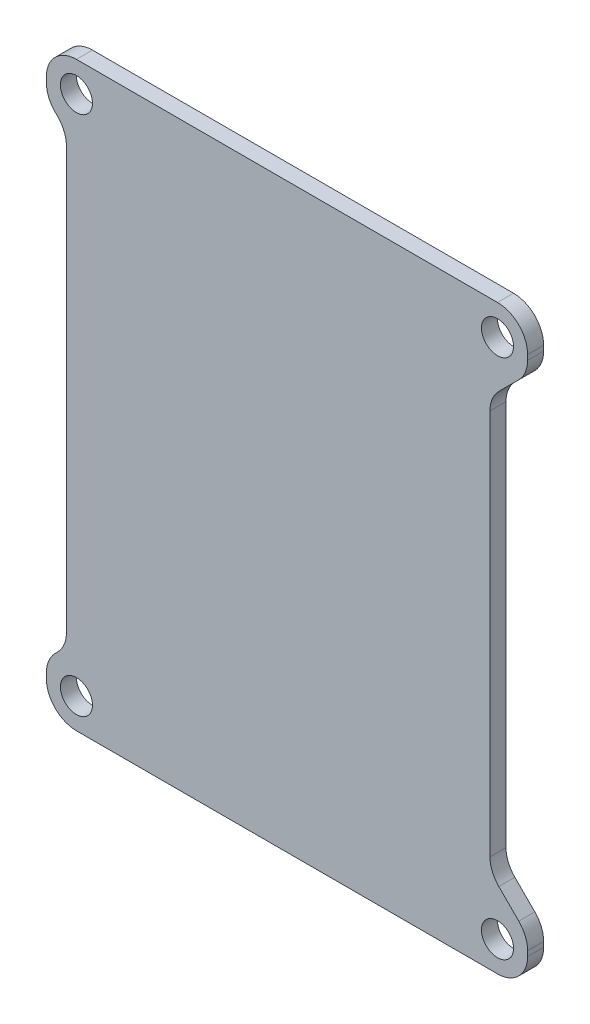
from build123d import *

# Parameters (mm, degrees)
SKETCH1_R           = 1.6
BOSS_EXTRUDE1_DEPTH = 1.6


with BuildPart() as part:
    # Sketch1 → Boss-Extrude1 (new body)
    with BuildSketch(Plane.XY):
        with BuildLine():
            Line((23.121320344, 23.378679656), (21.128679656, 21.386038969))
            ThreePointArc((21.128679656, 21.386038969), (20.478361402, 20.412768923), (20.25, 19.264718626))
            Line((20.25, 19.264718626), (20.25, -19.264718626))
            ThreePointArc((20.25, -19.264718626), (20.478361402, -20.412768923), (21.128679656, -21.386038969))
            Line((21.128679656, -21.386038969), (23.121320344, -23.378679656))
            ThreePointArc((23.121320344, -23.378679656), (23.771638598, -24.351949703), (24, -25.5))
            Line((24, -25.5), (24, -26))
            ThreePointArc((24, -26), (23.121320344, -28.121320344), (21, -29))
            Line((21, -29), (-21, -29))
            ThreePointArc((-21, -29), (-23.121320344, -28.121320344), (-24, -26))
            Line((-24, -26), (-24, -25.5))
            ThreePointArc((-24, -25.5), (-23.771638598, -24.351949703), (-23.121320344, -23.378679656))
            Line((-23.121320344, -23.378679656), (-22.878679656, -23.136038969))
            ThreePointArc((-22.878679656, -23.136038969), (-22.228361402, -22.162768923), (-22, -21.014718626))
            Line((-22, -21.014718626), (-22, 21.014718626))
            ThreePointArc((-22, 21.014718626), (-22.228361402, 22.162768923), (-22.878679656, 23.136038969))
            Line((-22.878679656, 23.136038969), (-23.121320344, 23.378679656))
            ThreePointArc((-23.121320344, 23.378679656), (-23.771638598, 24.351949703), (-24, 25.5))
            Line((-24, 25.5), (-24, 26))
            ThreePointArc((-24, 26), (-23.121320344, 28.121320344), (-21, 29))
            Line((-21, 29), (21, 29))
            ThreePointArc((21, 29), (23.121320344, 28.121320344), (24, 26))
            Line((24, 26), (24, 25.5))
            ThreePointArc((24, 25.5), (23.771638598, 24.351949703), (23.121320344, 23.378679656))
        make_face()
        with Locations((-21, 26)):
            Circle(SKETCH1_R, mode=Mode.SUBTRACT)
        with Locations((21, 26)):
            Circle(SKETCH1_R, mode=Mode.SUBTRACT)
        with Locations((21, -26)):
            Circle(SKETCH1_R, mode=Mode.SUBTRACT)
        with Locations((-21, -26)):
            Circle(SKETCH1_R, mode=Mode.SUBTRACT)
    extrude(amount=BOSS_EXTRUDE1_DEPTH)


solid = part.part
